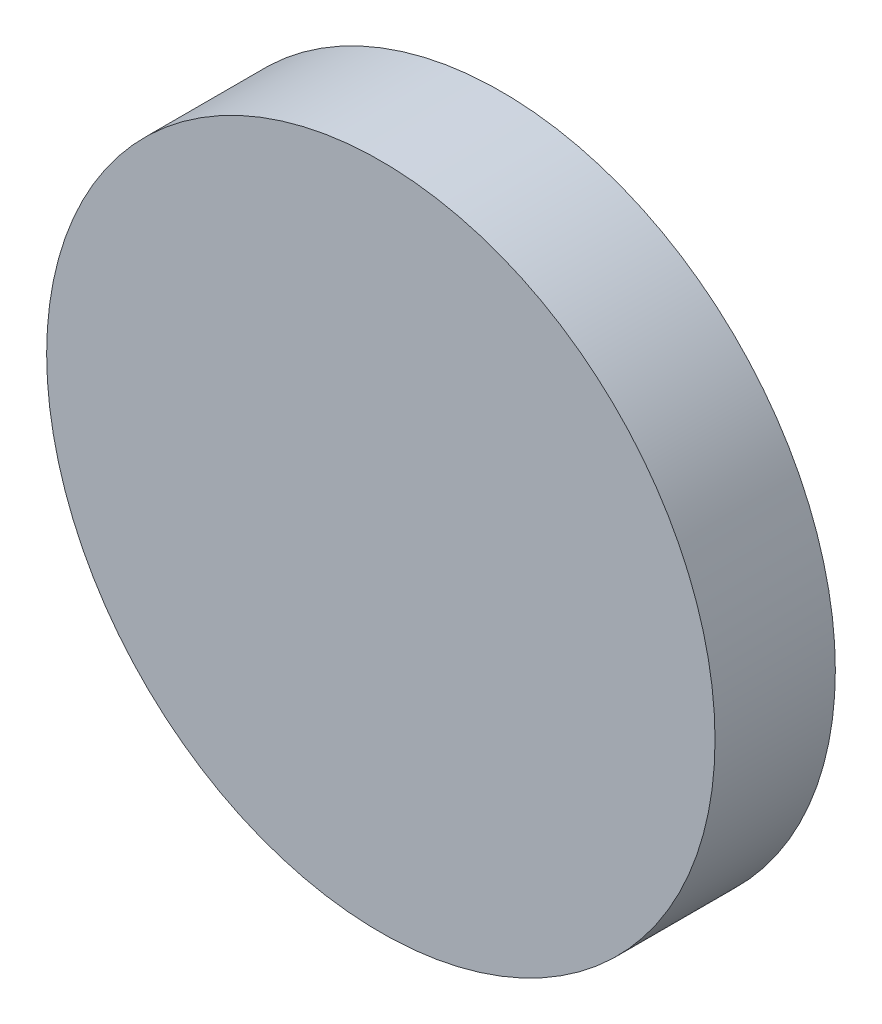
from build123d import *

# Parameters (mm, degrees)
SKETCH1_R           = 100
BOSS_EXTRUDE1_DEPTH = 36
SKETCH2_R           = 97
CUT_EXTRUDE2_DEPTH  = 33
SKETCH3_R           = 1.75
SKETCH3_R_2         = 7
SKETCH3_W           = 10
SKETCH3_H           = 14
CUT_EXTRUDE4_DEPTH  = 4


with BuildPart() as part:
    # Sketch1 → Boss-Extrude1 (new body)
    with BuildSketch(Plane.XY):
        Circle(SKETCH1_R)
    extrude(amount=BOSS_EXTRUDE1_DEPTH)

    # Sketch2 → Cut-Extrude2 (cut)
    with BuildSketch(Plane.XY):
        Circle(SKETCH2_R)
    extrude(amount=CUT_EXTRUDE2_DEPTH, mode=Mode.SUBTRACT)

    # Sketch3 → Cut-Extrude4 (cut)
    with BuildSketch(Plane.XY):
        with Locations((110, 24.75)):
            Circle(SKETCH3_R)
        with Locations((110, -24.75)):
            Circle(SKETCH3_R)
        with Locations((110, 0)):
            Circle(SKETCH3_R_2)
        with Locations((-93, 0)):
            Rectangle(SKETCH3_W, SKETCH3_H)
    extrude(amount=CUT_EXTRUDE4_DEPTH, mode=Mode.SUBTRACT)


solid = part.part
